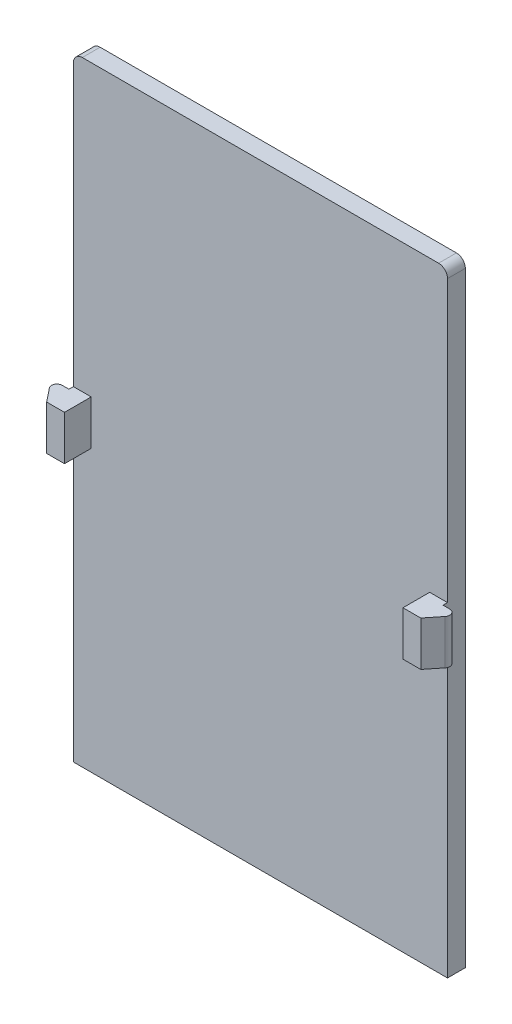
from build123d import *

# Parameters (mm, degrees)
SKETCH1_W           = 46
SKETCH1_H           = 73
BOSS_EXTRUDE1_DEPTH = 2
SKETCH2_W           = 2
SKETCH2_H           = 5
BOSS_EXTRUDE2_DEPTH = 3
BOSS_EXTRUDE3_DEPTH = 5
FILLET1_R           = 0.6
FILLET2_R           = 5
SKETCH5_W           = 46
SKETCH5_H           = 73
SKETCH5_W_2         = 42
SKETCH5_H_2         = 69
CUT_EXTRUDE1_DEPTH  = 10
FILLET3_R           = 1
SKETCH6_W           = 4.312342675
SKETCH6_H           = 2.937978419
SKETCH6_W_2         = 4.686780993
SKETCH6_H_2         = 2.65792504
CUT_EXTRUDE2_DEPTH  = 10
BOSS_EXTRUDE4_DEPTH = 5
FILLET4_R           = 0.6


with BuildPart() as part:
    # Sketch1 → Boss-Extrude1 (new body)
    with BuildSketch(Plane.XY):
        with Locations((23, -36.5)):
            Rectangle(SKETCH1_W, SKETCH1_H)
    extrude(amount=BOSS_EXTRUDE1_DEPTH)

    # Sketch2 → Boss-Extrude2 (add)
    with BuildSketch(Plane.XY.offset(2)):
        with Locations((3, -37)):
            Rectangle(SKETCH2_W, SKETCH2_H)
        with Locations((43, -37)):
            Rectangle(SKETCH2_W, SKETCH2_H)
    extrude(amount=BOSS_EXTRUDE2_DEPTH)

    # Sketch3 → Boss-Extrude3 (add)
    with BuildSketch(Plane.XZ.offset(39.5)):
        Polygon((2, 5), (0, 5), (2, 7), (4, 7), (4, 5), align=None)
        Polygon((44, 5), (46, 5), (44, 7), (42, 7), (42, 5), align=None)
    extrude(amount=-BOSS_EXTRUDE3_DEPTH)

    # Fillet1
    fillet1_edges = [part.edges().sort_by_distance(p)[0] for p in [
        (0, -37, 5),
        (46, -37, 5),
    ]]
    fillet(fillet1_edges, radius=FILLET1_R)

    # Fillet2
    fillet2_edges = [part.edges().sort_by_distance(p)[0] for p in [
        (0, 0, 1),
        (46, 0, 1),
    ]]
    fillet(fillet2_edges, radius=FILLET2_R)

    # Sketch5 → Cut-Extrude1 (cut)
    with BuildSketch(Plane.XY.offset(2)):
        with Locations((23, -36.5)):
            Rectangle(SKETCH5_W, SKETCH5_H)
        with Locations((23, -36.5)):
            Rectangle(SKETCH5_W_2, SKETCH5_H_2, mode=Mode.SUBTRACT)
    extrude(amount=-CUT_EXTRUDE1_DEPTH, mode=Mode.SUBTRACT)

    # Fillet3
    fillet3_edges = [part.edges().sort_by_distance(p)[0] for p in [
        (2, -2, 1),
        (44, -2, 1),
    ]]
    fillet(fillet3_edges, radius=FILLET3_R)

    # Sketch6 → Cut-Extrude2 (cut)
    with BuildSketch(Plane.XZ.offset(39.5)):
        with Locations((1.843828662, 6.46898921)):
            Rectangle(SKETCH6_W, SKETCH6_H)
        with Locations((44.343390497, 6.32896252)):
            Rectangle(SKETCH6_W_2, SKETCH6_H_2)
    extrude(amount=-CUT_EXTRUDE2_DEPTH, mode=Mode.SUBTRACT)

    # Sketch7 → Boss-Extrude4 (add)
    with BuildSketch(Plane.XZ.offset(39.5)):
        Polygon((2, 2.5), (0, 2.5), (2, 5), (4, 5), (4, 2.5), align=None)
        Polygon((42, 2.5), (46, 2.5), (44, 5), (42, 5), align=None)
    extrude(amount=-BOSS_EXTRUDE4_DEPTH)

    # Fillet4
    fillet4_edges = [part.edges().sort_by_distance(p)[0] for p in [
        (0, -37, 2.5),
        (46, -37, 2.5),
    ]]
    fillet(fillet4_edges, radius=FILLET4_R)


solid = part.part
